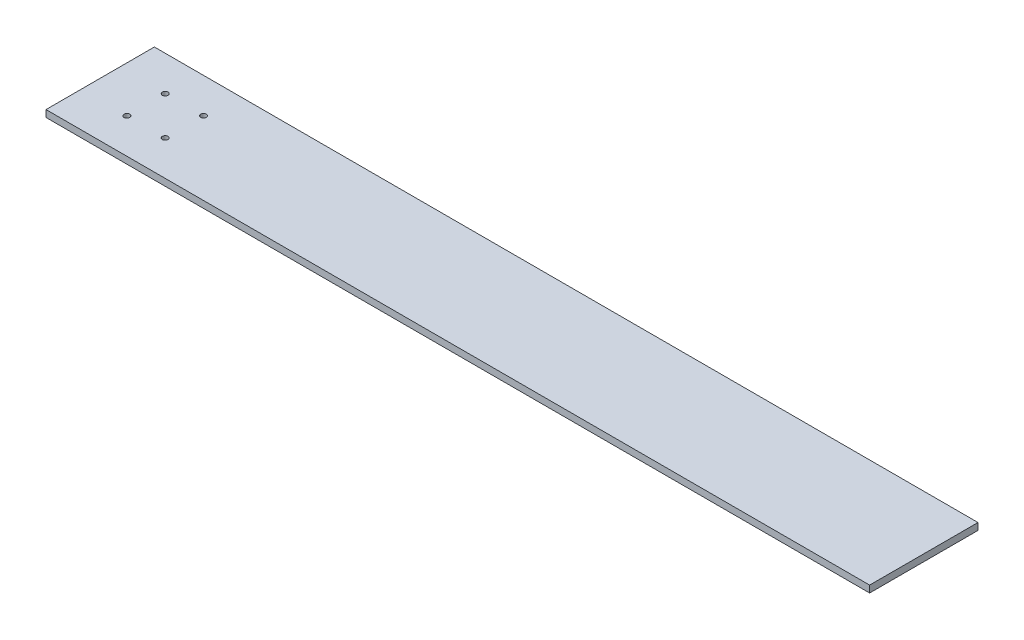
from build123d import *

# Parameters (mm, degrees)
SKETCH1_W           = 760
SKETCH1_H           = 100
BOSS_EXTRUDE1_DEPTH = 6.35
SKETCH2_R           = 2.625
CUT_EXTRUDE1_DEPTH  = 767.577016679


with BuildPart() as part:
    # Sketch1 → Boss-Extrude1 (new body)
    with BuildSketch(Plane(origin=(0, 0, 0), x_dir=(1, 0, 0), z_dir=(0, 1, 0))):
        with Locations((380, 50)):
            Rectangle(SKETCH1_W, SKETCH1_H)
    extrude(amount=BOSS_EXTRUDE1_DEPTH)

    # Sketch2 → Cut-Extrude1 (cut, through all)
    with BuildSketch(Plane(origin=(0, 6.35, 0), x_dir=(1, 0, 0), z_dir=(0, 1, 0))):
        with Locations(Location((42.3225, 67.6775, 0), (0, 0, 270))):
            Circle(SKETCH2_R)
        with Locations(Location((77.6775, 67.6775, 0), (0, 0, 270))):
            Circle(SKETCH2_R)
        with Locations(Location((77.6775, 32.3225, 0), (0, 0, 270))):
            Circle(SKETCH2_R)
        with Locations(Location((42.3225, 32.3225, 0), (0, 0, 270))):
            Circle(SKETCH2_R)
    extrude(amount=-CUT_EXTRUDE1_DEPTH, mode=Mode.SUBTRACT)


solid = part.part
